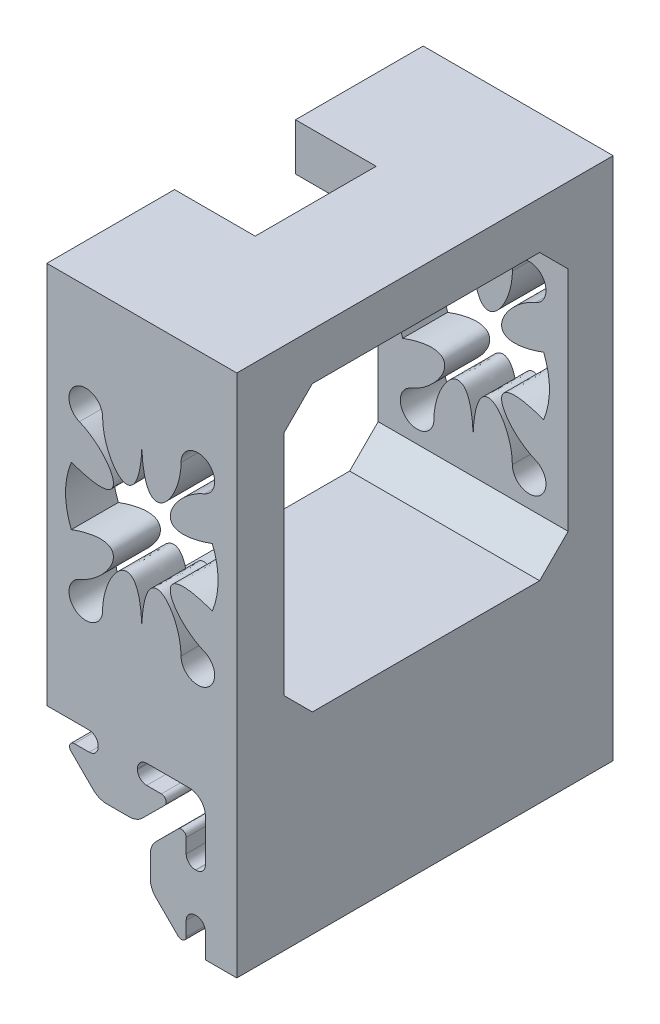
from build123d import *

# Parameters (mm, degrees)
BOSS_EXTRUDE1_DEPTH     = 56
CUT_EXTRUDE1_DEPTH      = 56
CUT_EXTRUDE2_DEPTH      = 10
CUT_EXTRUDE3_DEPTH      = 92.389771857
CUT_EXTRUDE3_DEPTH_BACK = 92.389771857


with BuildPart() as part:
    # Sketch1 → Boss-Extrude1 (new body)
    with BuildSketch(Plane.XY):
        with BuildLine():
            Line((13.02, -7.9417418), (17.7, -7.9417418))
            Line((17.7, -7.9417418), (17.7, 70.02))
            Line((17.7, 70.02), (-10.566443095, 70.02))
            Line((-10.566443095, 70.02), (-10.566443095, 13.02))
            Line((-10.566443095, 13.02), (-5.317126718, 13.02))
            Line((-5.317126718, 13.02), (-4.287512407, 13.02))
            ThreePointArc((-4.287512407, 13.02), (-3.319474451, 12.619025549), (-2.9185, 11.650987593))
            Line((-2.9185, 11.650987593), (-2.9185, 11.539212407))
            ThreePointArc((-2.9185, 11.539212407), (-3.319474451, 10.571174451), (-4.287512407, 10.1702))
            Line((-4.287512407, 10.1702), (-6.476788598, 10.1702))
            ThreePointArc((-6.476788598, 10.1702), (-7.136510935, 9.729114651), (-6.981020848, 8.950903446))
            Line((-6.981020848, 8.950903446), (-3.672257405, 5.649701928))
            ThreePointArc((-3.672257405, 5.649701928), (-2.746830644, 5.032499411), (-1.655778399, 4.8158))
            Line((-1.655778399, 4.8158), (1.655778399, 4.8158))
            ThreePointArc((1.655778399, 4.8158), (2.746830644, 5.032499411), (3.672257405, 5.649701928))
            Line((3.672257405, 5.649701928), (6.981020848, 8.950903446))
            ThreePointArc((6.981020848, 8.950903446), (7.136510935, 9.729114651), (6.476788598, 10.1702))
            Line((6.476788598, 10.1702), (4.287512407, 10.1702))
            ThreePointArc((4.287512407, 10.1702), (3.319474451, 10.571174451), (2.9185, 11.539212407))
            Line((2.9185, 11.539212407), (2.9185, 11.650987593))
            ThreePointArc((2.9185, 11.650987593), (3.319474451, 12.619025549), (4.287512407, 13.02))
            Line((4.287512407, 13.02), (6.332886163, 13.02))
            Line((6.332886163, 13.02), (10.562594215, 13.019824354))
            ThreePointArc((10.562594215, 13.019824354), (12.303594776, 12.313982883), (13.019956614, 10.577284622))
            Line((13.019956614, 10.577284622), (13.02, 4.287469289))
            ThreePointArc((13.02, 4.287469289), (12.619025549, 3.319431332), (11.650987593, 2.918456882))
            Line((11.650987593, 2.918456882), (11.539212407, 2.918456882))
            ThreePointArc((11.539212407, 2.918456882), (10.571174451, 3.319431332), (10.1702, 4.287469289))
            Line((10.1702, 4.287469289), (10.1702, 6.402089023))
            ThreePointArc((10.1702, 6.402089023), (9.733877283, 7.055496588), (8.963146507, 6.90287605))
            Line((8.963146507, 6.90287605), (5.667020993, 3.614283579))
            ThreePointArc((5.667020993, 3.614283579), (5.046449321, 2.687255303), (4.8285, 1.593185507))
            Line((4.8285, 1.593185507), (4.8285, -1.593185507))
            ThreePointArc((4.8285, -1.593185507), (5.046449321, -2.687255303), (5.667020993, -3.614283579))
            Line((5.667020993, -3.614283579), (8.963146507, -6.90287605))
            ThreePointArc((8.963146507, -6.90287605), (9.733877283, -7.055496588), (10.1702, -6.402089023))
            Line((10.1702, -6.402089023), (10.1702, -4.287469289))
            ThreePointArc((10.1702, -4.287469289), (10.571174451, -3.319431332), (11.539212407, -2.918456882))
            Line((11.539212407, -2.918456882), (11.650987593, -2.918456882))
            ThreePointArc((11.650987593, -2.918456882), (12.619025549, -3.319431332), (13.02, -4.287469289))
            Line((13.02, -4.287469289), (13.02, -5.3170836))
            Line((13.02, -5.3170836), (13.02, -7.9417418))
        make_face()
    extrude(amount=BOSS_EXTRUDE1_DEPTH)

    # Sketch14 → Cut-Extrude1 (cut)
    with BuildSketch(Plane(origin=(17.7, 0, 0), x_dir=(0, 0, -1), z_dir=(1, 0, 0))):
        Polygon((-44.757359313, 20.72), (-10.942640687, 20.72), (-6.7, 24.962640687), (-6.7, 58.777359313), (-10.942640687, 63.02), (-44.757359313, 63.02), (-49, 58.777359313), (-49, 24.962640687), align=None)
    extrude(amount=-CUT_EXTRUDE1_DEPTH, mode=Mode.SUBTRACT)

    # Sketch15 → Cut-Extrude2 (cut)
    with BuildSketch(Plane(origin=(0, 70.02, 0), x_dir=(1, 0, 0), z_dir=(0, 1, 0))):
        Polygon((-10.566443095, -19), (1.433556905, -19), (1.433556905, -37), (-10.566443095, -37), (-15.100276482, -37), (-15.100276482, -19), align=None)
    extrude(amount=-CUT_EXTRUDE2_DEPTH, mode=Mode.SUBTRACT)

    # Sketch17 → Cut-Extrude3 (cut, two sides: drawn at the far end of the back side and taken through both)
    with BuildSketch(Plane(origin=(0, 0, 0), x_dir=(-1, 0, 0), z_dir=(0, 0, -1)).offset(-CUT_EXTRUDE3_DEPTH_BACK)):
        with BuildLine():
            ThreePointArc((-9.400838819, 54.341705489), (-13.28984888, 56.420323071), (-12.857359659, 52.031928902))
            add(Edge.make_bspline(
                [(-12.857359659, 52.031928902), (-7.769707663, 49.925038916), (-4.147275589, 42.622189217), (-14.053422003, 46.212711393)],
                knots=[0, 0, 0, 0, 1, 1, 1, 1], degree=3))
            ThreePointArc((-14.053422003, 46.212711393), (-14.917057533, 41.87), (-14.053422003, 37.527288607))
            add(Edge.make_bspline(
                [(-12.857359659, 31.708071098), (-7.769707663, 33.814961084), (-4.147275589, 41.117810783), (-14.053422003, 37.527288607)],
                knots=[0, 0, 0, 0, 1, 1, 1, 1], degree=3))
            ThreePointArc((-12.857359659, 31.708071098), (-13.28984888, 27.319676929), (-9.400838819, 29.398294511))
            add(Edge.make_bspline(
                [(-9.400838819, 29.398294511), (-9.400838819, 34.904943968), (-4.039631026, 41.045878657), (-3.566778452, 30.51972092)],
                knots=[0, 0, 0, 0, 1, 1, 1, 1], degree=3))
            add(Edge.make_bspline(
                [(2.267281914, 29.398294511), (2.267281914, 34.904943968), (-3.093925879, 41.045878657), (-3.566778452, 30.51972092)],
                knots=[0, 0, 0, 0, 1, 1, 1, 1], degree=3))
            ThreePointArc((2.267281914, 29.398294511), (6.156291975, 27.319676929), (5.723802754, 31.708071098))
            add(Edge.make_bspline(
                [(5.723802754, 31.708071098), (0.636150758, 33.814961084), (-2.986281315, 41.117810783), (6.919865099, 37.527288607)],
                knots=[0, 0, 0, 0, 1, 1, 1, 1], degree=3))
            ThreePointArc((6.919865099, 37.527288607), (7.783500628, 41.87), (6.919865099, 46.212711393))
            add(Edge.make_bspline(
                [(5.723802754, 52.031928902), (0.636150758, 49.925038916), (-2.986281315, 42.622189217), (6.919865099, 46.212711393)],
                knots=[0, 0, 0, 0, 1, 1, 1, 1], degree=3))
            ThreePointArc((5.723802754, 52.031928902), (6.156291975, 56.420323071), (2.267281914, 54.341705489))
            add(Edge.make_bspline(
                [(2.267281914, 54.341705489), (2.267281914, 48.835056032), (-3.093925879, 42.694121343), (-3.566778452, 53.22027908)],
                knots=[0, 0, 0, 0, 1, 1, 1, 1], degree=3))
            add(Edge.make_bspline(
                [(-9.400838819, 54.341705489), (-9.400838819, 48.835056032), (-4.039631026, 42.694121343), (-3.566778452, 53.22027908)],
                knots=[0, 0, 0, 0, 1, 1, 1, 1], degree=3))
        make_face()
    extrude(amount=CUT_EXTRUDE3_DEPTH + CUT_EXTRUDE3_DEPTH_BACK, mode=Mode.SUBTRACT)


solid = part.part
